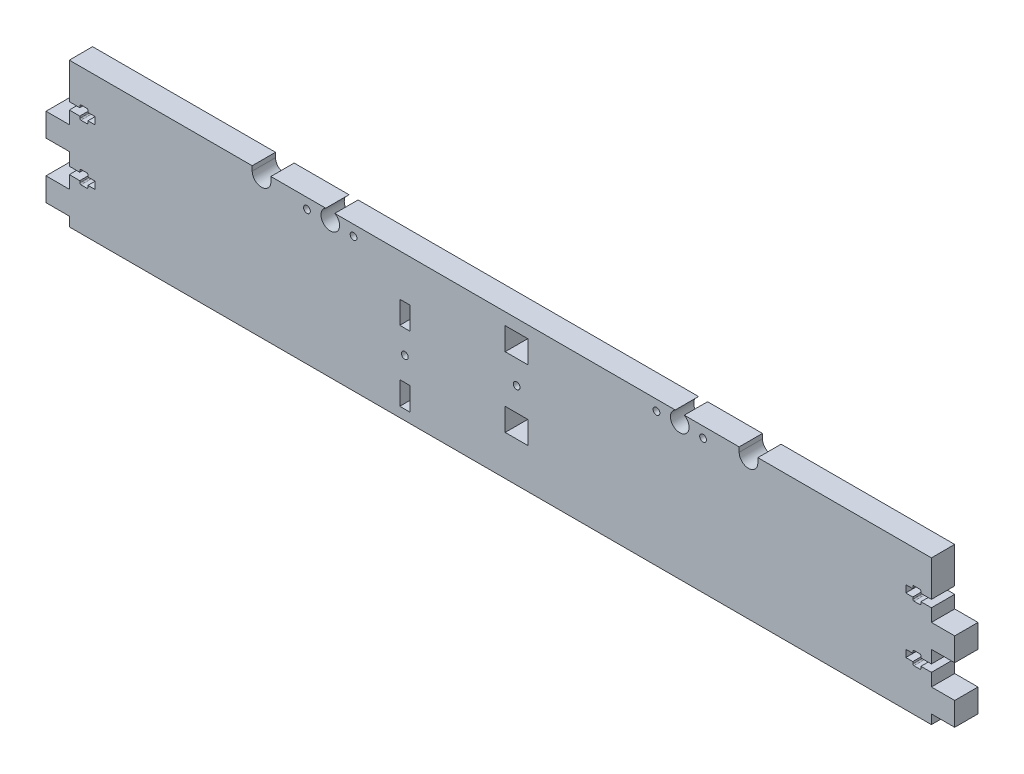
from build123d import *

# Parameters (mm, degrees)
MAINBODY_DEPTH      = 10
SCREWCUTOUTS_DEPTH  = 205.863369102
SKETCH2_R           = 4
SKETCH2_R_2         = 1.45
RODCUTOUTS_DEPTH    = 205.863369102
SKETCH4_R           = 1.45
SKETCH4_W           = 9.85
SKETCH4_H           = 9.7
CUT_EXTRUDE3_DEPTH  = 205.863369102
SKETCH5_R           = 1.45
SKETCH5_W           = 4.35
SKETCH5_H           = 9.7
SKETCH5_H_2         = 9.9
ENDSTOPHOLDER_DEPTH = 205.863369102
CUT_EXTRUDE4_DEPTH  = 205.863369102


with BuildPart() as part:
    # Sketch1 → MainBody (new body)
    with BuildSketch(Plane.XY):
        Polygon((0, 0), (-185, 0), (-185, -24), (-195, -24), (-195, -34), (-185, -34), (-185, -48), (-195, -48), (-195, -58), (-185, -58), (-185, -62), (0, -62), align=None)
    mainbody = extrude(amount=MAINBODY_DEPTH)

    # Sketch3 → ScrewCutouts (cut, through all)
    with BuildSketch(Plane.XY.offset(10)):
        with BuildLine():
            Line((-185, -18.55), (-180.5, -18.55))
            Line((-180.5, -18.55), (-180.5, -19.35))
            ThreePointArc((-180.5, -19.35), (-180.353553391, -19.703553391), (-180, -19.85))
            Line((-180, -19.85), (-177.5, -19.85))
            ThreePointArc((-177.5, -19.85), (-177.146446609, -19.703553391), (-177, -19.35))
            Line((-177, -19.35), (-177, -18.55))
            Line((-177, -18.55), (-174, -18.55))
            Line((-174, -18.55), (-174, -15.45))
            Line((-174, -15.45), (-177, -15.45))
            Line((-177, -15.45), (-177, -14.65))
            ThreePointArc((-177, -14.65), (-177.146446609, -14.296446609), (-177.5, -14.15))
            Line((-177.5, -14.15), (-180, -14.15))
            ThreePointArc((-180, -14.15), (-180.353553391, -14.296446609), (-180.5, -14.65))
            Line((-180.5, -14.65), (-180.5, -15.45))
            Line((-180.5, -15.45), (-185, -15.45))
            Line((-185, -15.45), (-185, -18.55))
        make_face()
        with BuildLine():
            Line((-185, -39.45), (-185, -42.55))
            Line((-185, -42.55), (-180.5, -42.55))
            Line((-180.5, -42.55), (-180.5, -43.35))
            ThreePointArc((-180.5, -43.35), (-180.353553391, -43.703553391), (-180, -43.85))
            Line((-180, -43.85), (-177.5, -43.85))
            ThreePointArc((-177.5, -43.85), (-177.146446609, -43.703553391), (-177, -43.35))
            Line((-177, -43.35), (-177, -42.55))
            Line((-177, -42.55), (-174, -42.55))
            Line((-174, -42.55), (-174, -39.45))
            Line((-174, -39.45), (-177, -39.45))
            Line((-177, -39.45), (-177, -38.65))
            ThreePointArc((-177, -38.65), (-177.146446609, -38.296446609), (-177.5, -38.15))
            Line((-177.5, -38.15), (-180, -38.15))
            ThreePointArc((-180, -38.15), (-180.353553391, -38.296446609), (-180.5, -38.65))
            Line((-180.5, -38.65), (-180.5, -39.45))
            Line((-180.5, -39.45), (-185, -39.45))
        make_face()
    screwcutouts = extrude(amount=-SCREWCUTOUTS_DEPTH, mode=Mode.SUBTRACT)

    # Mirror1: MainBody, ScrewCutouts across plane
    add(mainbody.mirror(Plane(origin=(0, 0, 0), x_dir=(0, 0, 1), z_dir=(1, 0, 0))))
    add(screwcutouts.mirror(Plane(origin=(0, 0, 0), x_dir=(0, 0, 1), z_dir=(1, 0, 0))), mode=Mode.SUBTRACT)

    # Sketch2 → RodCutouts (cut, through all)
    with BuildSketch(Plane.XY.offset(10)):
        with Locations((-73, -3.5)):
            Circle(SKETCH2_R)
        with Locations((-83, -4.5)):
            Circle(SKETCH2_R_2)
        with Locations(Location((-63, -4.5, 0), (0, 0, 180))):
            Circle(SKETCH2_R_2)
        with Locations((67, -4.5)):
            Circle(SKETCH2_R_2)
        with Locations(Location((87, -4.5, 0), (0, 0, 180))):
            Circle(SKETCH2_R_2)
        with Locations((77, -3.5)):
            Circle(SKETCH2_R)
    extrude(amount=-RODCUTOUTS_DEPTH, mode=Mode.SUBTRACT)

    # Sketch4 → Cut-Extrude3 (cut, through all)
    with BuildSketch(Plane.XY.offset(10)):
        with Locations((7, -25)):
            Circle(SKETCH4_R)
        with Locations((7, -10)):
            Rectangle(SKETCH4_W, SKETCH4_H)
        with Locations((7, -40)):
            Rectangle(SKETCH4_W, SKETCH4_H)
    extrude(amount=-CUT_EXTRUDE3_DEPTH, mode=Mode.SUBTRACT)

    # Sketch5 → EndstopHolder (cut, through all)
    with BuildSketch(Plane.XY.offset(10)):
        with Locations((-41, -37.75)):
            Circle(SKETCH5_R)
        with Locations((-41, -22.8)):
            Rectangle(SKETCH5_W, SKETCH5_H)
        with Locations((-41, -52.8)):
            Rectangle(SKETCH5_W, SKETCH5_H_2)
        with BuildLine():
            Line((-31.425, 8.994431211), (-31.425, 5))
            ThreePointArc((-31.425, 5), (-34.625, 1.8), (-37.825, 5))
            Line((-37.825, 5), (-37.825, 8.994431211))
            ThreePointArc((-37.825, 8.994431211), (-34.625, 12.194431211), (-31.425, 8.994431211))
        make_face()
    extrude(amount=-ENDSTOPHOLDER_DEPTH, mode=Mode.SUBTRACT)

    # Sketch7 → Cut-Extrude4 (cut, through all)
    with BuildSketch(Plane.XY.offset(10)):
        with BuildLine():
            Line((-98.5, 0), (-98.5, -2))
            ThreePointArc((-98.5, -2), (-102.5, -6), (-106.5, -2))
            Line((-106.5, -2), (-106.5, 0))
            ThreePointArc((-106.5, 0), (-102.5, 4), (-98.5, 0))
        make_face()
        with BuildLine():
            Line((102.5, 0), (102.5, -2))
            ThreePointArc((102.5, -2), (106.5, -6), (110.5, -2))
            Line((110.5, -2), (110.5, 0))
            ThreePointArc((110.5, 0), (106.5, 4), (102.5, 0))
        make_face()
    extrude(amount=-CUT_EXTRUDE4_DEPTH, mode=Mode.SUBTRACT)


solid = part.part
